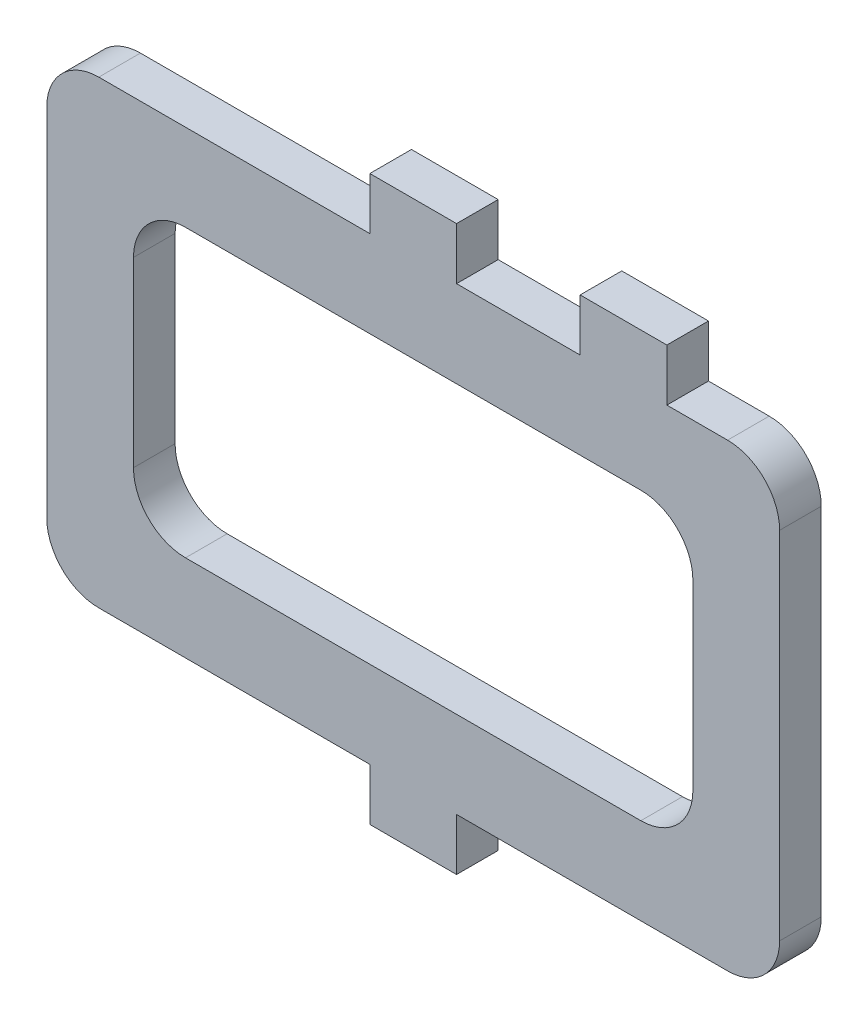
from build123d import *

# Parameters (mm, degrees)
SALIENTE_EXTRUIR1_DEPTH = 2.4
CORTAR_EXTRUIR1_DEPTH   = 4


with BuildPart() as part:
    # Croquis1 → Saliente-Extruir1 (new body)
    with BuildSketch(Plane.XY):
        with BuildLine():
            Line((-102.615102368, -90.721952824), (-86.990102368, -90.721952824))
            ThreePointArc((-86.990102368, -90.721952824), (-84.868782024, -89.843273168), (-83.990102368, -87.721952824))
            Line((-83.990102368, -87.721952824), (-83.990102368, -67.221952824))
            ThreePointArc((-83.990102368, -67.221952824), (-84.868782024, -65.10063248), (-86.990102368, -64.221952824))
            Line((-86.990102368, -64.221952824), (-90.490102368, -64.221952824))
            Line((-90.490102368, -64.221952824), (-90.490102368, -61.221952824))
            Line((-90.490102368, -61.221952824), (-95.490102368, -61.221952824))
            Line((-95.490102368, -61.221952824), (-95.490102368, -64.221952824))
            Line((-95.490102368, -64.221952824), (-102.615102368, -64.221952824))
            Line((-102.615102368, -64.221952824), (-102.615102368, -61.221952824))
            Line((-102.615102368, -61.221952824), (-105.115102368, -61.221952824))
            Line((-105.115102368, -61.221952824), (-107.615102368, -61.221952824))
            Line((-107.615102368, -61.221952824), (-107.615102368, -64.221952824))
            Line((-107.615102368, -64.221952824), (-123.240102368, -64.221952824))
            ThreePointArc((-123.240102368, -64.221952824), (-125.361422711, -65.10063248), (-126.240102368, -67.221952824))
            Line((-126.240102368, -67.221952824), (-126.240102368, -87.721952824))
            ThreePointArc((-126.240102368, -87.721952824), (-125.361422711, -89.843273168), (-123.240102368, -90.721952824))
            Line((-123.240102368, -90.721952824), (-107.615102368, -90.721952824))
            Line((-107.615102368, -90.721952824), (-107.615102368, -93.721952824))
            Line((-107.615102368, -93.721952824), (-102.615102368, -93.721952824))
            Line((-102.615102368, -93.721952824), (-102.615102368, -90.721952824))
        make_face()
    extrude(amount=SALIENTE_EXTRUIR1_DEPTH)

    # Croquis2 → Cortar-Extruir1 (cut)
    with BuildSketch(Plane.XY.offset(2.4)):
        with BuildLine():
            Line((-115.427602368, -69.221952824), (-91.990102368, -69.221952824))
            ThreePointArc((-91.990102368, -69.221952824), (-89.868782024, -70.10063248), (-88.990102368, -72.221952824))
            Line((-88.990102368, -72.221952824), (-88.990102368, -82.721952824))
            ThreePointArc((-88.990102368, -82.721952824), (-89.868782024, -84.843273168), (-91.990102368, -85.721952824))
            Line((-91.990102368, -85.721952824), (-118.240102368, -85.721952824))
            ThreePointArc((-118.240102368, -85.721952824), (-120.361422711, -84.843273168), (-121.240102368, -82.721952824))
            Line((-121.240102368, -82.721952824), (-121.240102368, -72.221952824))
            ThreePointArc((-121.240102368, -72.221952824), (-120.361422711, -70.10063248), (-118.240102368, -69.221952824))
            Line((-118.240102368, -69.221952824), (-115.427602368, -69.221952824))
        make_face()
    extrude(amount=-CORTAR_EXTRUIR1_DEPTH, mode=Mode.SUBTRACT)


solid = part.part
